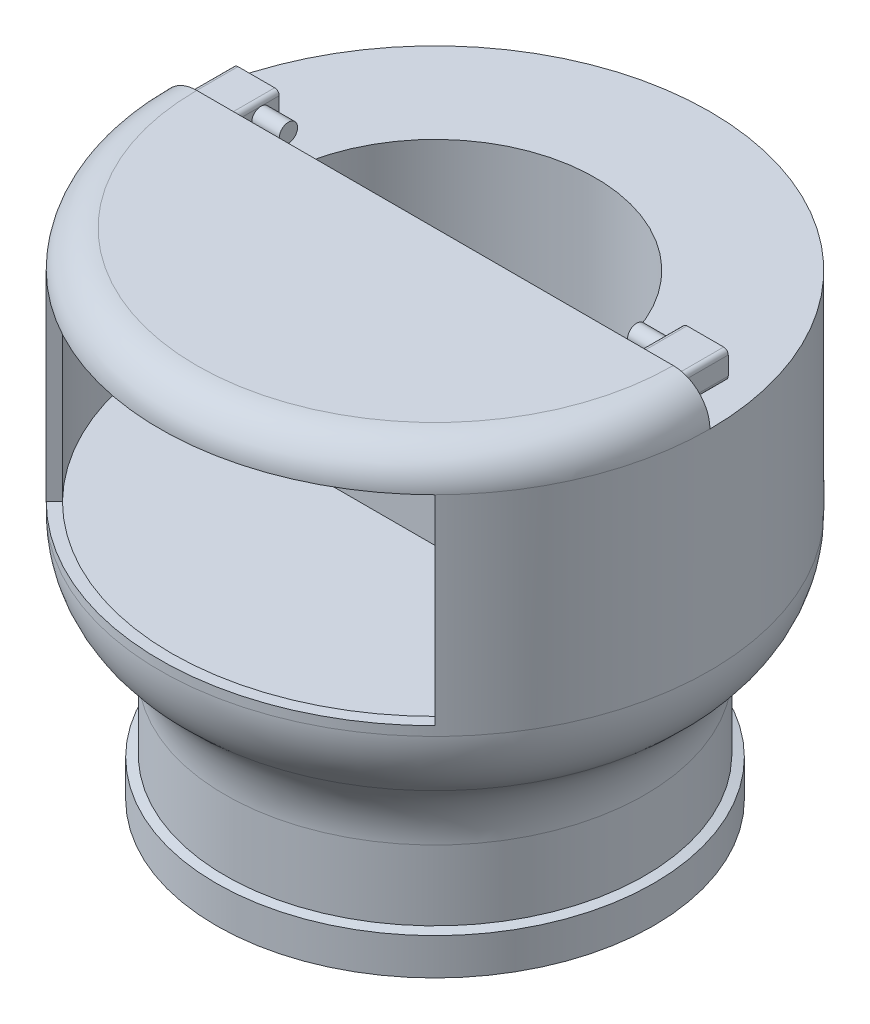
from build123d import *

# Parameters (mm, degrees)
CUT_EXTRUDE3_DEPTH           = 45
CUT_EXTRUDE3_DEPTH_BACK      = 20
CUT_EXTRUDE5_START           = -5
CUT_EXTRUDE5_DEPTH           = 5
BOSS_EXTRUDE2_DEPTH          = 5
SKETCH14_R                   = 1
BOSS_EXTRUDE3_DEPTH          = 3
BOSS_EXTRUDE4_START          = 3
SKETCH15_R                   = 1
BOSS_EXTRUDE4_DEPTH          = 3
CUT_EXTRUDE6_DEPTH           = 22
SKETCH18_W                   = 1.5
SKETCH18_H                   = 21.826980301
CUT_REVOLVE1_ANGLE           = 45
CUT_REVOLVE1_OTHER_WAY_ANGLE = 45


with BuildPart() as part:
    # Sketch1 → Revolve1 (revolve)
    with BuildSketch(Plane.XY, mode=Mode.PRIVATE) as revolve1_sk:
        with BuildLine():
            Line((20.9, 0), (23.871591838, 0))
            Line((23.871591838, 0), (23.871591838, 4))
            Line((23.871591838, 4), (22.9, 4.236662843))
            Line((22.9, 4.236662843), (22.9, 11.874576818))
            ThreePointArc((22.9, 11.874576818), (23.83692213, 16.100759435), (26.472123903, 19.535021249))
            Line((26.472123903, 19.535021249), (26.427876097, 19.497892931))
            ThreePointArc((26.427876097, 19.497892931), (29.06307787, 22.932154745), (30, 27.158337362))
            Line((30, 27.158337362), (30, 50))
            ThreePointArc((30, 50), (28.828427125, 52.828427125), (26, 54))
            Line((26, 54), (0, 54))
            Line((0, 54), (0, 15))
            Line((0, 15), (19.9, 15))
            ThreePointArc((19.9, 15), (20.607106781, 14.707106781), (20.9, 14))
            Line((20.9, 14), (20.9, 0))
        make_face()
    revolve(revolve1_sk.sketch.rotate(Axis((0, 0, 0), (0, 1, 0)), 90), axis=Axis((0, 0, 0), (0, 1, 0)))

    # Sketch11 → Cut-Extrude3 (cut, two sides: drawn at the far end of the back side and taken through both)
    with BuildSketch(Plane(origin=(0, 17, 0), x_dir=(1, 0, 0), z_dir=(0, 1, 0)).offset(-CUT_EXTRUDE3_DEPTH_BACK)):
        with BuildLine():
            Line((-17.5, 0), (17.5, 0))
            ThreePointArc((17.5, 0), (0, 17.5), (-17.5, 0))
        make_face()
    extrude(amount=CUT_EXTRUDE3_DEPTH + CUT_EXTRUDE3_DEPTH_BACK, mode=Mode.SUBTRACT)

    # Sketch9 → Cut-Extrude5 (cut)
    with BuildSketch(Plane(origin=(0, 50, 0), x_dir=(-1, 0, 0), z_dir=(0, -1, 0)).offset(CUT_EXTRUDE5_START)):
        with BuildLine():
            Line((-30, 0), (30, 0))
            ThreePointArc((30, 0), (0, 30), (-30, 0))
        make_face()
    extrude(amount=CUT_EXTRUDE5_DEPTH, mode=Mode.SUBTRACT)

    # Sketch13 → Boss-Extrude2 (add)
    with BuildSketch(Plane(origin=(0, 0, 0), x_dir=(-1, 0, 0), z_dir=(0, 0, -1))):
        with BuildLine():
            Line((22.5, 53.5), (26.5, 53.5))
            ThreePointArc((26.5, 53.5), (26.853553391, 53.353553391), (27, 53))
            Line((27, 53), (27, 51))
            ThreePointArc((27, 51), (26.853553391, 50.646446609), (26.5, 50.5))
            Line((26.5, 50.5), (22.5, 50.5))
            ThreePointArc((22.5, 50.5), (22.146446609, 50.646446609), (22, 51))
            Line((22, 51), (22, 53))
            ThreePointArc((22, 53), (22.146446609, 53.353553391), (22.5, 53.5))
        make_face()
        with BuildLine():
            Line((-26.5, 53.5), (-22.5, 53.5))
            ThreePointArc((-22.5, 53.5), (-22.146446609, 53.353553391), (-22, 53))
            Line((-22, 53), (-22, 51))
            ThreePointArc((-22, 51), (-22.146446609, 50.646446609), (-22.5, 50.5))
            Line((-22.5, 50.5), (-26.5, 50.5))
            ThreePointArc((-26.5, 50.5), (-26.853553391, 50.646446609), (-27, 51))
            Line((-27, 51), (-27, 53))
            ThreePointArc((-27, 53), (-26.853553391, 53.353553391), (-26.5, 53.5))
        make_face()
    extrude(amount=BOSS_EXTRUDE2_DEPTH)

    # Sketch14 → Boss-Extrude3 (add)
    with BuildSketch(Plane.ZY.offset(-22)):
        with Locations(Location((-3, 52, 0), (0, 0, 270))):
            Circle(SKETCH14_R)
    extrude(amount=BOSS_EXTRUDE3_DEPTH)

    # Sketch15 → Boss-Extrude4 (add)
    with BuildSketch(Plane(origin=(-22, 0, 0), x_dir=(0, 0, -1), z_dir=(1, 0, 0)).offset(BOSS_EXTRUDE4_START)):
        with Locations(Location((3, 52, 0), (0, 0, 270))):
            Circle(SKETCH15_R)
    extrude(amount=-BOSS_EXTRUDE4_DEPTH)

    # Sketch16 → Cut-Extrude6 (cut)
    with BuildSketch(Plane(origin=(0, 50, 0), x_dir=(-1, 0, 0), z_dir=(0, -1, 0))):
        with BuildLine():
            Line((28.470379344, -4), (-28.470379344, -4))
            ThreePointArc((-28.470379344, -4), (0, -28.75), (28.470379344, -4))
        make_face()
    extrude(amount=CUT_EXTRUDE6_DEPTH, mode=Mode.SUBTRACT)

    # Sketch18 → Cut-Revolve1 (revolve, cut)
    with BuildSketch(Plane(origin=(0, 0, 0), x_dir=(0, 0, -1), z_dir=(1, 0, 0))):
        with Locations((-29.25, 39.08650985)):
            Rectangle(SKETCH18_W, SKETCH18_H)
    revolve(axis=Axis((0, 0, 0), (0, 1, 0)), revolution_arc=CUT_REVOLVE1_ANGLE, mode=Mode.SUBTRACT)

    # Sketch18 → Cut-Revolve1 other way (revolve, cut)
    with BuildSketch(Plane(origin=(0, 0, 0), x_dir=(0, 0, -1), z_dir=(1, 0, 0))):
        with Locations((-29.25, 39.08650985)):
            Rectangle(SKETCH18_W, SKETCH18_H)
    revolve(axis=Axis((0, 0, 0), (0, -1, 0)), revolution_arc=CUT_REVOLVE1_OTHER_WAY_ANGLE, mode=Mode.SUBTRACT)


solid = part.part
